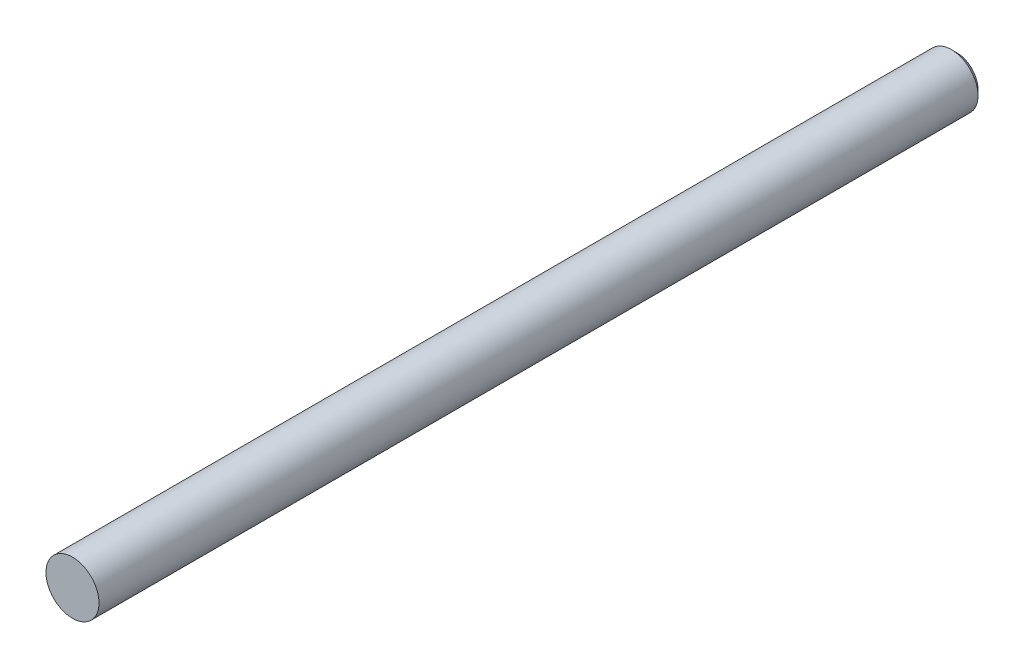
from build123d import *

# Parameters (mm, degrees)
SKETCH1_R          = 3
EXTRUDE1_DEPTH     = 100
CHAMFER1_SIZE      = 0.6
SKETCH3_R          = 10.435428451
CUT_EXTRUDE1_DEPTH = 100


with BuildPart() as part:
    # Sketch1 → Extrude1 (new, symmetric)
    with BuildSketch(Plane.XY):
        Circle(SKETCH1_R)
    extrude(amount=EXTRUDE1_DEPTH, both=True)

    # Chamfer1
    chamfer1_edges = [part.edges().sort_by_distance(p)[0] for p in [
        (-3, 0, -100),
        (-3, 0, 100),
    ]]
    chamfer(chamfer1_edges, length=CHAMFER1_SIZE)

    # Sketch3 → Cut-Extrude1 (cut)
    with BuildSketch(Plane.XY.offset(100)):
        Circle(SKETCH3_R)
    extrude(amount=-CUT_EXTRUDE1_DEPTH, mode=Mode.SUBTRACT)


solid = part.part
